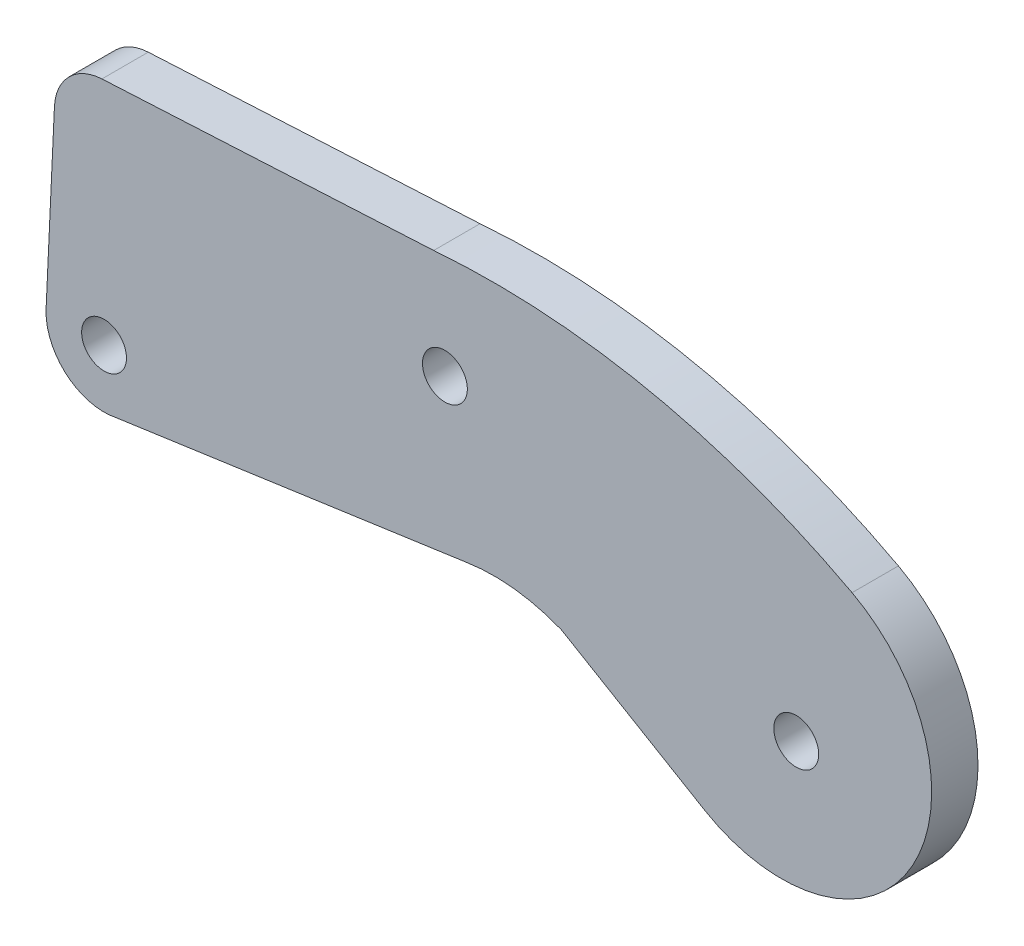
from build123d import *

# Parameters (mm, degrees)
SKETCH1_R           = 3
BOSS_EXTRUDE1_DEPTH = 6.2


with BuildPart() as part:
    # Sketch1 → Boss-Extrude1 (new body)
    with BuildSketch(Plane.XY):
        with BuildLine():
            Line((-44, -26.8), (2.7, -20.15))
            ThreePointArc((2.7, -20.15), (9.249876076, -19.98611928), (15.6, -21.599705241))
            Line((15.6, -21.599705241), (34.768435899, -32.920104396))
            ThreePointArc((34.768435899, -32.920104396), (62.542861937, -25.448265408), (54.469609673, 2.157344845))
            ThreePointArc((54.469609673, 2.157344845), (27.320189876, 11.997539893), (-1.5, 13.818827736))
            Line((-1.5, 13.818827736), (-45.886645473, 11.5))
            ThreePointArc((-45.886645473, 11.5), (-50.294249478, 9.530490598), (-52.238519213, 5.111694886))
            Line((-52.238519213, 5.111694886), (-53.366350091, -19.138305114))
            ThreePointArc((-53.366350091, -19.138305114), (-50.517454676, -25.21154219), (-44, -26.8))
        make_face()
        with Locations(Location((47, -18.8, 0), (0, 0, 180))):
            Circle(SKETCH1_R, mode=Mode.SUBTRACT)
        with Locations(Location((-45.6, -19.2, 0), (0, 0, 180))):
            Circle(SKETCH1_R, mode=Mode.SUBTRACT)
        with Locations(Location((0, 0, 0), (0, 0, 180))):
            Circle(SKETCH1_R, mode=Mode.SUBTRACT)
    extrude(amount=BOSS_EXTRUDE1_DEPTH)


solid = part.part
